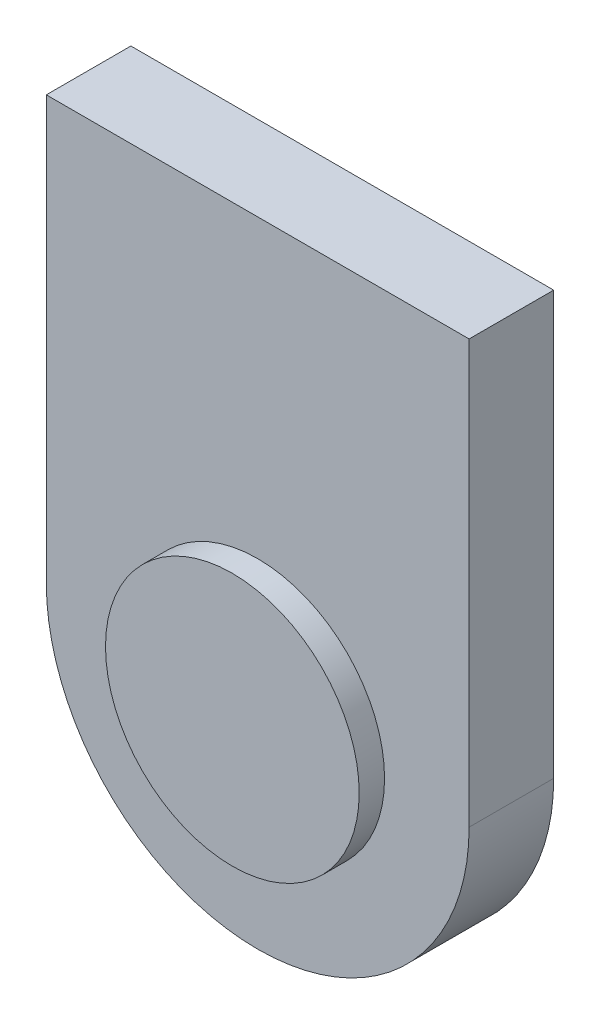
from build123d import *

# Parameters (mm, degrees)
BOSS_EXTRUDE1_DEPTH = 5
SKETCH3_R           = 15
BOSS_EXTRUDE2_DEPTH = 3


with BuildPart() as part:
    # Sketch1 → Boss-Extrude1 (new, symmetric)
    with BuildSketch(Plane.XY):
        with BuildLine():
            Line((-25, 0), (-25, 50))
            Line((-25, 50), (25, 50))
            Line((25, 50), (25, 0))
            ThreePointArc((25, 0), (0, -25), (-25, 0))
        make_face()
    extrude(amount=BOSS_EXTRUDE1_DEPTH, both=True)

    # Sketch3 → Boss-Extrude2 (add)
    with BuildSketch(Plane.XY.offset(5)):
        Circle(SKETCH3_R)
    extrude(amount=BOSS_EXTRUDE2_DEPTH)


solid = part.part
